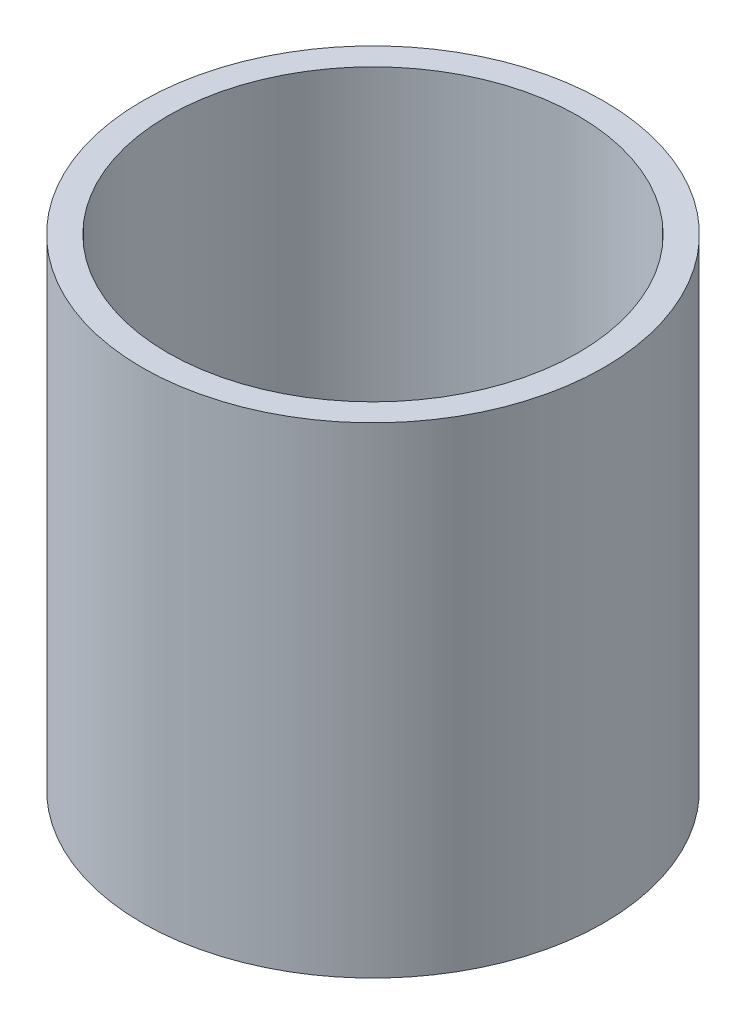
from build123d import *

# Parameters (mm, degrees)
SKETCH1_R           = 4.572
BOSS_EXTRUDE1_DEPTH = 9.525
SKETCH2_R           = 4.064
CUT_EXTRUDE1_DEPTH  = 12.512254036


with BuildPart() as part:
    # Sketch1 → Boss-Extrude1 (new body)
    with BuildSketch(Plane(origin=(0, 0, 0), x_dir=(1, 0, 0), z_dir=(0, 1, 0))):
        with Locations(Location((0, 0, 0), (0, 0, 90))):
            Circle(SKETCH1_R)
    extrude(amount=BOSS_EXTRUDE1_DEPTH)

    # Sketch2 → Cut-Extrude1 (cut, through all)
    with BuildSketch(Plane(origin=(0, 9.525, 0), x_dir=(1, 0, 0), z_dir=(0, 1, 0))):
        with Locations(Location((0, 0, 0), (0, 0, 270))):
            Circle(SKETCH2_R)
    extrude(amount=-CUT_EXTRUDE1_DEPTH, mode=Mode.SUBTRACT)


solid = part.part
